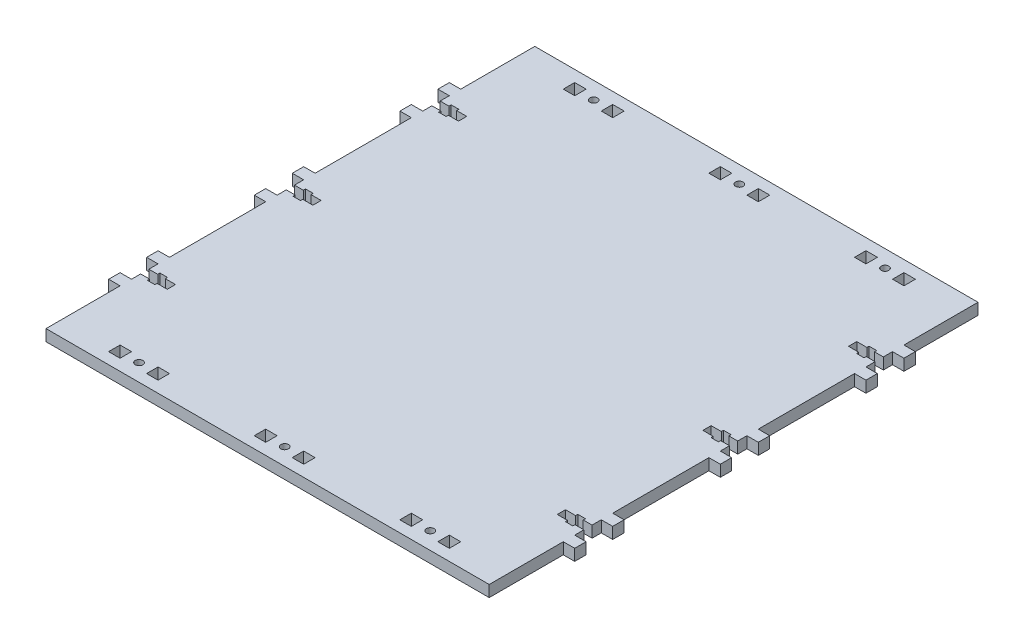
from build123d import *

# Parameters (mm, degrees)
SKETCH1_W           = 9.05
SKETCH1_H           = 9.05
SKETCH1_R           = 3
BOSS_EXTRUDE1_DEPTH = 9


with BuildPart() as part:
    # Sketch1 → Boss-Extrude1 (new body)
    with BuildSketch(Plane(origin=(0, 0, 0), x_dir=(1, 0, 0), z_dir=(0, 1, 0))):
        Polygon((-175, -134.5), (-175, -193), (175, -193), (175, -134.5), (184, -134.5), (184, -125.5), (175, -125.5), (175, -118.25), (168, -118.25), (168, -119.975), (162, -119.975), (162, -118.25), (154, -118.25), (154, -111.75), (162, -111.75), (162, -110.025), (168, -110.025), (168, -111.75), (175, -111.75), (175, -104.5), (184, -104.5), (184, -95.5), (175, -95.5), (175, -19.5), (184, -19.5), (184, -10.5), (175, -10.5), (175, -3.25), (168, -3.25), (168, -4.975), (162, -4.975), (162, -3.25), (154, -3.25), (154, 3.25), (162, 3.25), (162, 4.975), (168, 4.975), (168, 3.25), (175, 3.25), (175, 10.5), (184, 10.5), (184, 19.5), (175, 19.5), (175, 95.5), (184, 95.5), (184, 104.5), (175, 104.5), (175, 111.75), (168, 111.75), (168, 110.025), (162, 110.025), (162, 111.75), (154, 111.75), (154, 118.25), (162, 118.25), (162, 119.975), (168, 119.975), (168, 118.25), (175, 118.25), (175, 125.5), (184, 125.5), (184, 134.5), (175, 134.5), (175, 193), (-175, 193), (-175, 134.5), (-184, 134.5), (-184, 125.5), (-175, 125.5), (-175, 118.25), (-168, 118.25), (-168, 119.975), (-162, 119.975), (-162, 118.25), (-154, 118.25), (-154, 111.75), (-162, 111.75), (-162, 110.025), (-168, 110.025), (-168, 111.75), (-175, 111.75), (-175, 104.5), (-184, 104.5), (-184, 95.5), (-175, 95.5), (-175, 19.5), (-184, 19.5), (-184, 10.5), (-175, 10.5), (-175, 3.25), (-168, 3.25), (-168, 4.975), (-162, 4.975), (-162, 3.25), (-154, 3.25), (-154, -3.25), (-162, -3.25), (-162, -4.975), (-168, -4.975), (-168, -3.25), (-175, -3.25), (-175, -10.5), (-184, -10.5), (-184, -19.5), (-175, -19.5), (-175, -95.5), (-184, -95.5), (-184, -104.5), (-175, -104.5), (-175, -111.75), (-168, -111.75), (-168, -110.025), (-162, -110.025), (-162, -111.75), (-154, -111.75), (-154, -118.25), (-162, -118.25), (-162, -119.975), (-168, -119.975), (-168, -118.25), (-175, -118.25), (-175, -125.5), (-184, -125.5), (-184, -134.5), align=None)
        with Locations((-130, -179.525)):
            Rectangle(SKETCH1_W, SKETCH1_H, mode=Mode.SUBTRACT)
        with Locations(Location((-115, -179.525, 0), (0, 0, 270))):
            Circle(SKETCH1_R, mode=Mode.SUBTRACT)
        with Locations((-100, -179.525)):
            Rectangle(SKETCH1_W, SKETCH1_H, mode=Mode.SUBTRACT)
        with Locations((-15, -179.525)):
            Rectangle(SKETCH1_W, SKETCH1_H, mode=Mode.SUBTRACT)
        with Locations(Location((0, -179.525, 0), (0, 0, 270))):
            Circle(SKETCH1_R, mode=Mode.SUBTRACT)
        with Locations((15, -179.525)):
            Rectangle(SKETCH1_W, SKETCH1_H, mode=Mode.SUBTRACT)
        with Locations((100, -179.525)):
            Rectangle(SKETCH1_W, SKETCH1_H, mode=Mode.SUBTRACT)
        with Locations(Location((115, -179.525, 0), (0, 0, 270))):
            Circle(SKETCH1_R, mode=Mode.SUBTRACT)
        with Locations((130, -179.525)):
            Rectangle(SKETCH1_W, SKETCH1_H, mode=Mode.SUBTRACT)
        with Locations((-130, 179.525)):
            Rectangle(SKETCH1_W, SKETCH1_H, mode=Mode.SUBTRACT)
        with Locations(Location((-115, 179.525, 0), (0, 0, 270))):
            Circle(SKETCH1_R, mode=Mode.SUBTRACT)
        with Locations((-100, 179.525)):
            Rectangle(SKETCH1_W, SKETCH1_H, mode=Mode.SUBTRACT)
        with Locations((-15, 179.525)):
            Rectangle(SKETCH1_W, SKETCH1_H, mode=Mode.SUBTRACT)
        with Locations(Location((0, 179.525, 0), (0, 0, 270))):
            Circle(SKETCH1_R, mode=Mode.SUBTRACT)
        with Locations((15, 179.525)):
            Rectangle(SKETCH1_W, SKETCH1_H, mode=Mode.SUBTRACT)
        with Locations((100, 179.525)):
            Rectangle(SKETCH1_W, SKETCH1_H, mode=Mode.SUBTRACT)
        with Locations(Location((115, 179.525, 0), (0, 0, 270))):
            Circle(SKETCH1_R, mode=Mode.SUBTRACT)
        with Locations((130, 179.525)):
            Rectangle(SKETCH1_W, SKETCH1_H, mode=Mode.SUBTRACT)
    extrude(amount=BOSS_EXTRUDE1_DEPTH)


solid = part.part
